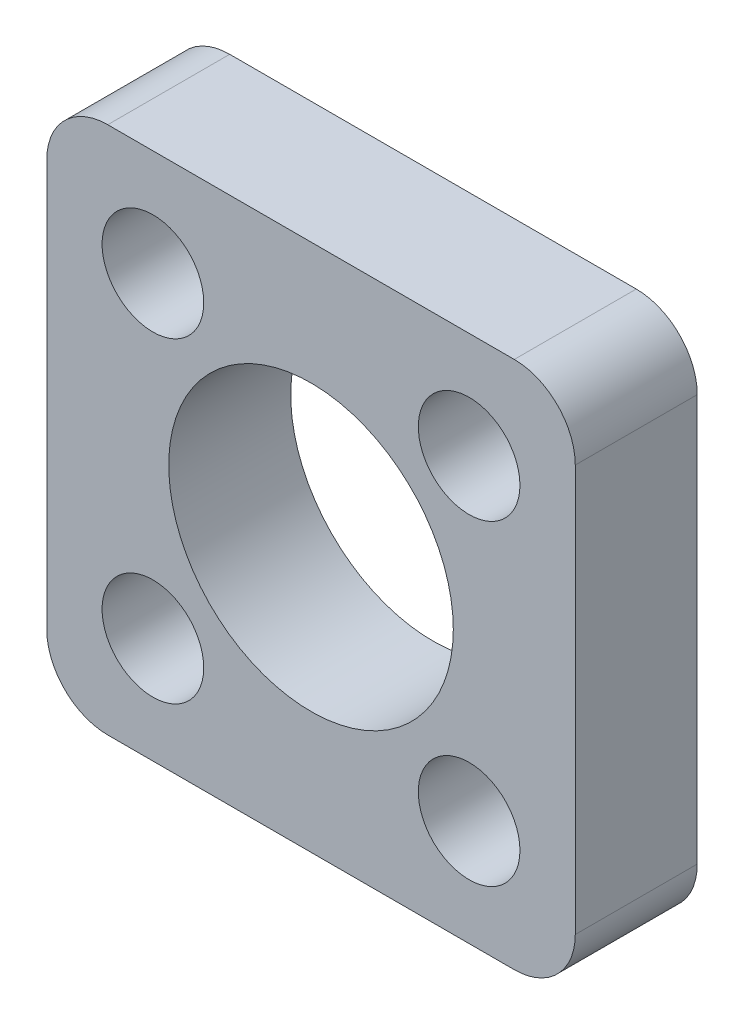
from build123d import *

# Parameters (mm, degrees)
SKETCH1_R           = 3.5
SKETCH1_R_2         = 1.25
BOSS_EXTRUDE1_DEPTH = 3


with BuildPart() as part:
    # Sketch1 → Boss-Extrude1 (new body)
    with BuildSketch(Plane.XY):
        with BuildLine():
            Line((5, -6.5), (-5, -6.5))
            ThreePointArc((-5, -6.5), (-6.060660172, -6.060660172), (-6.5, -5))
            Line((-6.5, -5), (-6.5, 5))
            ThreePointArc((-6.5, 5), (-6.060660172, 6.060660172), (-5, 6.5))
            Line((-5, 6.5), (5, 6.5))
            ThreePointArc((5, 6.5), (6.060660172, 6.060660172), (6.5, 5))
            Line((6.5, 5), (6.5, -5))
            ThreePointArc((6.5, -5), (6.060660172, -6.060660172), (5, -6.5))
        make_face()
        Circle(SKETCH1_R, mode=Mode.SUBTRACT)
        with Locations((-3.889087297, 3.889087297)):
            Circle(SKETCH1_R_2, mode=Mode.SUBTRACT)
        with Locations((3.889087297, 3.889087297)):
            Circle(SKETCH1_R_2, mode=Mode.SUBTRACT)
        with Locations((3.889087297, -3.889087297)):
            Circle(SKETCH1_R_2, mode=Mode.SUBTRACT)
        with Locations((-3.889087297, -3.889087297)):
            Circle(SKETCH1_R_2, mode=Mode.SUBTRACT)
    extrude(amount=BOSS_EXTRUDE1_DEPTH)


solid = part.part
